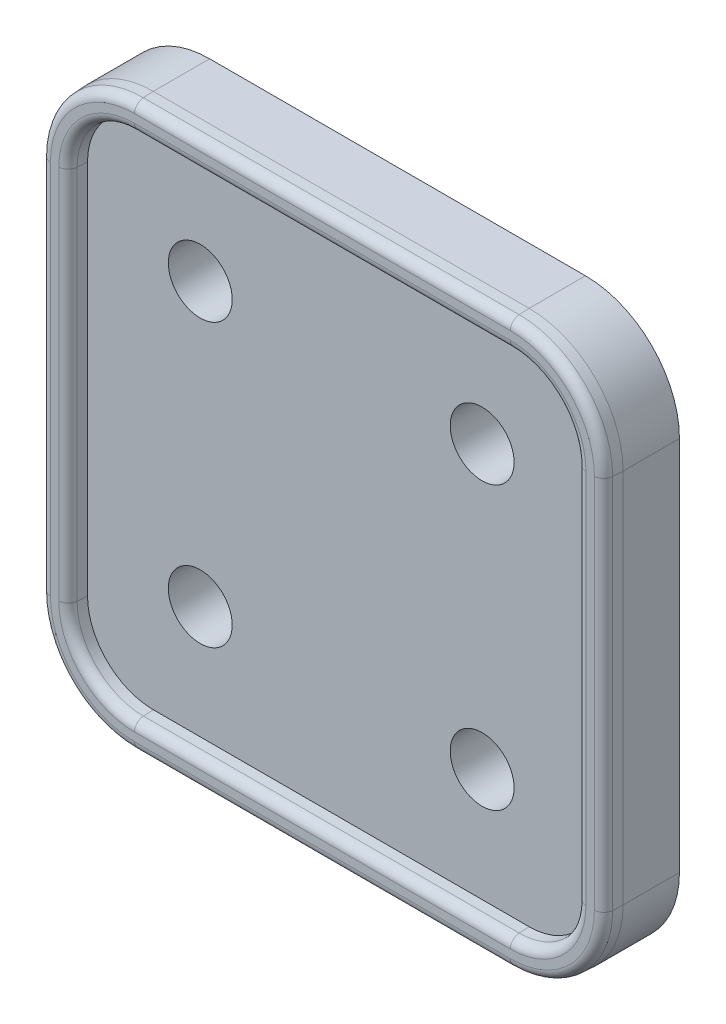
from build123d import *

# Parameters (mm, degrees)
BOSS_EXTRUDE1_DEPTH = 3
SKETCH2_R           = 1.7
CUT_EXTRUDE1_DEPTH  = 43.532340636
BOSS_EXTRUDE2_DEPTH = 1
BOSS_EXTRUDE2_DRAFT = 3
FILLET1_R           = 0.5


with BuildPart() as part:
    # Sketch1 → Boss-Extrude1 (new body)
    with BuildSketch(Plane.XY):
        with BuildLine():
            Line((5, 30), (25, 30))
            ThreePointArc((25, 30), (28.535533906, 28.535533906), (30, 25))
            Line((30, 25), (30, 5))
            ThreePointArc((30, 5), (28.535533906, 1.464466094), (25, 0))
            Line((25, 0), (5, 0))
            ThreePointArc((5, 0), (1.464466094, 1.464466094), (0, 5))
            Line((0, 5), (0, 25))
            ThreePointArc((0, 25), (1.464466094, 28.535533906), (5, 30))
        make_face()
    extrude(amount=BOSS_EXTRUDE1_DEPTH)

    # Sketch2 → Cut-Extrude1 (cut, through all)
    with BuildSketch(Plane.XY.offset(3)):
        with Locations((22.5, 22.5)):
            Circle(SKETCH2_R)
        with Locations((7.5, 7.5)):
            Circle(SKETCH2_R)
        with Locations((7.5, 22.5)):
            Circle(SKETCH2_R)
        with Locations((22.5, 7.5)):
            Circle(SKETCH2_R)
    extrude(amount=-CUT_EXTRUDE1_DEPTH, mode=Mode.SUBTRACT)


with BuildPart() as boss_extrude2_tool:
    # Sketch3 → Boss-Extrude2 (with draft: the straight prism first)
    with BuildSketch(Plane.XY.offset(3)):
        with BuildLine():
            Line((30, 5), (30, 25))
            ThreePointArc((30, 25), (28.535533906, 28.535533906), (25, 30))
            Line((25, 30), (5, 30))
            ThreePointArc((5, 30), (1.464466094, 28.535533906), (0, 25))
            Line((0, 25), (0, 5))
            ThreePointArc((0, 5), (1.464466094, 1.464466094), (5, 0))
            Line((5, 0), (25, 0))
            ThreePointArc((25, 0), (28.535533906, 1.464466094), (30, 5))
        make_face()
        with BuildLine():
            Line((28.5, 25), (28.5, 5))
            ThreePointArc((28.5, 5), (27.474873734, 2.525126266), (25, 1.5))
            Line((25, 1.5), (5, 1.5))
            ThreePointArc((5, 1.5), (2.525126266, 2.525126266), (1.5, 5))
            Line((1.5, 5), (1.5, 25))
            ThreePointArc((1.5, 25), (2.525126266, 27.474873734), (5, 28.5))
            Line((5, 28.5), (25, 28.5))
            ThreePointArc((25, 28.5), (27.474873734, 27.474873734), (28.5, 25))
        make_face(mode=Mode.SUBTRACT)
    extrude(amount=BOSS_EXTRUDE2_DEPTH)
    # Boss-Extrude2: the draft: its side faces are tilted about the plane it starts from
    boss_extrude2_sides = [boss_extrude2_tool.faces().sort_by_distance(p)[0] for p in [
        (15, 0, 3.5),
        (28.535533906, 1.464466094, 3.5),
        (30, 15, 3.5),
        (28.535533906, 28.535533906, 3.5),
        (15, 30, 3.5),
        (1.464466094, 28.535533906, 3.5),
        (0, 15, 3.5),
        (1.464466094, 1.464466094, 3.5),
        (28.5, 15, 3.5),
        (27.474873734, 2.525126266, 3.5),
        (15, 1.5, 3.5),
        (2.525126266, 2.525126266, 3.5),
        (1.5, 15, 3.5),
        (2.525126266, 27.474873734, 3.5),
        (15, 28.5, 3.5),
        (27.474873734, 27.474873734, 3.5),
    ]]
    draft(boss_extrude2_sides, Plane.XY.offset(3), BOSS_EXTRUDE2_DRAFT)


with BuildPart() as part_1:
    add(part.part)

    # Boss-Extrude2: add boss_extrude2_tool
    add(boss_extrude2_tool.part)

    # Fillet1
    fillet1_edges = [part_1.edges().sort_by_distance(p)[0] for p in [
        (28.49847601, 1.50152399, 4),
        (29.947592221, 15, 4),
        (28.49847601, 28.49847601, 4),
        (15, 29.947592221, 4),
        (1.50152399, 28.49847601, 4),
        (0.052407779, 15, 4),
        (1.50152399, 1.50152399, 4),
        (15, 0.052407779, 4),
        (2.48806837, 2.48806837, 4),
        (15, 1.447592221, 4),
        (27.51193163, 2.48806837, 4),
        (28.552407779, 15, 4),
        (27.51193163, 27.51193163, 4),
        (15, 28.552407779, 4),
        (2.48806837, 27.51193163, 4),
        (1.447592221, 15, 4),
    ]]
    fillet(fillet1_edges, radius=FILLET1_R)


solid = part_1.part
